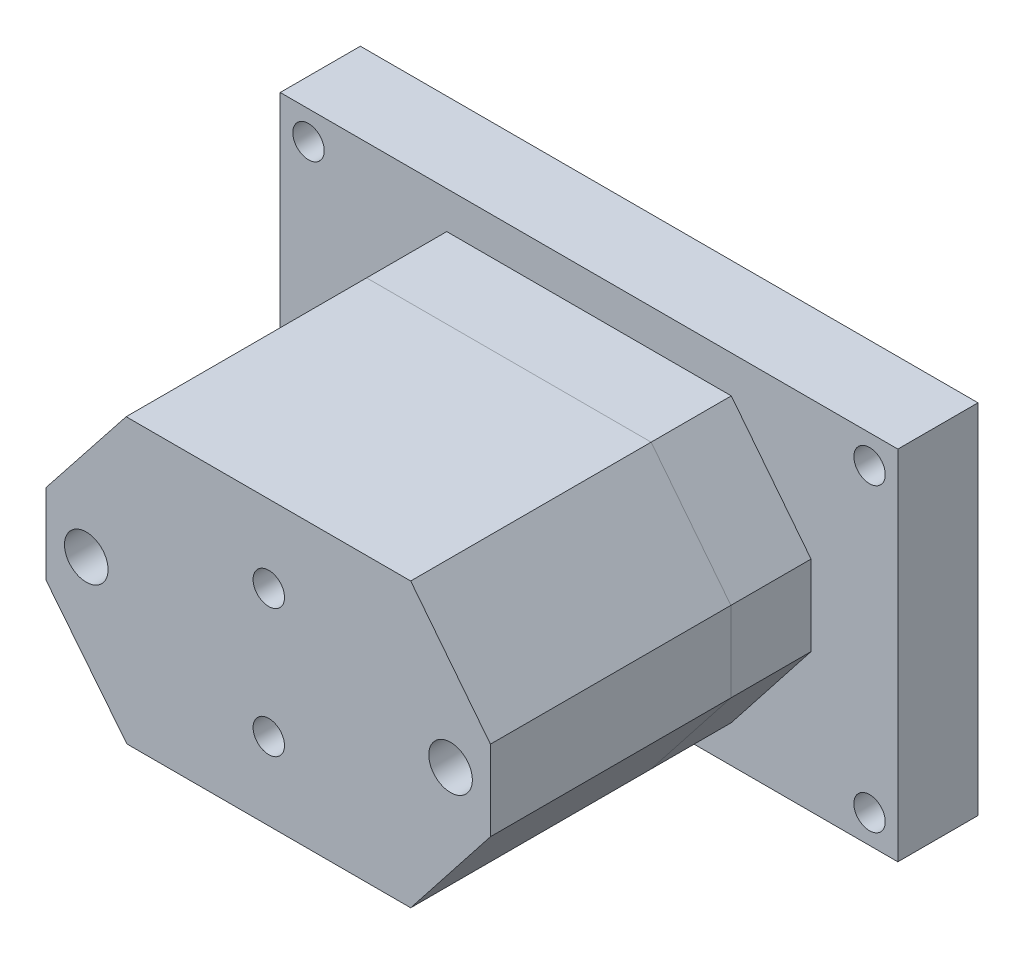
from build123d import *

# Parameters (mm, degrees)
CROQUIS1_W                   = 38.5
CROQUIS1_H                   = 38.5
CROQUIS1_R                   = 1.631954222
SALIENTE_EXTRUIR1_DEPTH      = 3.175
CROQUIS3_W                   = 45.084999084
CROQUIS3_H                   = 18.415000916
SALIENTE_EXTRUIR3_DEPTH      = 3.175
CROQUIS4_W                   = 18.415000916
CROQUIS4_H                   = 38.5
SALIENTE_EXTRUIR4_DEPTH      = 3.175
SALIENTE_EXTRUIR5_DEPTH      = 3.175
CROQUIS6_W                   = 45.084999084
CROQUIS6_H                   = 18.415000916
SALIENTE_EXTRUIR6_DEPTH      = 3.175
CROQUIS7_W                   = 12.817500305
CROQUIS7_H                   = 12.69999981
CROQUIS7_R                   = 2.4892
SALIENTE_EXTRUIR7_DEPTH      = 18.415001
SALIENTE_EXTRUIR8_DEPTH      = 35.179
SALIENTE_EXTRUIR8_DEPTH_BACK = 35.2425
CROQUIS10_W                  = 38.1
CROQUIS10_H                  = 44.85
CORTAR_EXTRUIR1_DEPTH        = 57.537814361
CROQUIS12_R                  = 12.7381
CORTAR_EXTRUIR2_DEPTH        = 71.036889764
CROQUIS13_R                  = 3.45
CORTAR_EXTRUIR3_DEPTH        = 73.335382738
CROQUIS14_R                  = 12.7381
SALIENTE_EXTRUIR9_DEPTH      = 3.175
CROQUIS15_R                  = 2.4892
CORTAR_EXTRUIR4_DEPTH        = 57.537814361
SALIENTE_EXTRUIR10_DEPTH     = 38.1
SALIENTE_EXTRUIR11_DEPTH     = 12.7
CROQUIS19_W                  = 97.8662
CROQUIS19_H                  = 56.642
CROQUIS19_R                  = 2.4892
SALIENTE_EXTRUIR12_DEPTH     = 12.7
CROQUIS20_R                  = 3.45
CROQUIS20_R_2                = 2.4892
CORTAR_EXTRUIR5_DEPTH        = 86.022216606


with BuildPart() as part:
    # Croquis1 → Saliente-Extruir1 (new body)
    with BuildSketch(Plane.XY):
        Rectangle(CROQUIS1_W, CROQUIS1_H)
        with Locations((-14, 14)):
            Circle(CROQUIS1_R, mode=Mode.SUBTRACT)
        with Locations((14, 14)):
            Circle(CROQUIS1_R, mode=Mode.SUBTRACT)
        with Locations(Location((14, -14, 0), (0, 0, 180))):
            Circle(CROQUIS1_R, mode=Mode.SUBTRACT)
        with Locations(Location((-14, -14, 0), (0, 0, 180))):
            Circle(CROQUIS1_R, mode=Mode.SUBTRACT)
        with BuildLine():
            Line((4.778981922, 6.730999947), (11.112500191, 6.730999947))
            Line((11.112500191, 6.730999947), (11.112500191, -6.730999947))
            Line((11.112500191, -6.730999947), (4.778981922, -6.730999947))
            ThreePointArc((4.778981922, -6.730999947), (0, -8.255000211), (-4.778981922, -6.730999947))
            Line((-4.778981922, -6.730999947), (-11.112500191, -6.730999947))
            Line((-11.112500191, -6.730999947), (-11.112500191, 6.730999947))
            Line((-11.112500191, 6.730999947), (-4.778981922, 6.730999947))
            ThreePointArc((-4.778981922, 6.730999947), (0, 8.255000211), (4.778981922, 6.730999947))
        make_face(mode=Mode.SUBTRACT)
    extrude(amount=SALIENTE_EXTRUIR1_DEPTH)

    # Croquis3 → Saliente-Extruir3 (add)
    with BuildSketch(Plane.XZ.offset(19.25)):
        with Locations((0, 9.207500458)):
            Rectangle(CROQUIS3_W, CROQUIS3_H)
    extrude(amount=SALIENTE_EXTRUIR3_DEPTH)

    # Croquis4 → Saliente-Extruir4 (add)
    with BuildSketch(Plane.ZY.offset(19.25)):
        with Locations((9.207500458, 0)):
            Rectangle(CROQUIS4_W, CROQUIS4_H)
    extrude(amount=SALIENTE_EXTRUIR4_DEPTH)

    # Croquis5 → Saliente-Extruir5 (add)
    with BuildSketch(Plane(origin=(19.25, 0, 0), x_dir=(0, 0, -1), z_dir=(1, 0, 0))):
        with BuildLine():
            Line((-12.617739677, -7.684936523), (-18.415000916, -7.684936523))
            Line((-18.415000916, -7.684936523), (-18.415000916, 19.25))
            Line((-18.415000916, 19.25), (0, 19.25))
            Line((0, 19.25), (0, -19.25))
            Line((0, -19.25), (-18.415000916, -19.25))
            Line((-18.415000916, -19.25), (-18.415000916, -12.304718971))
            Line((-18.415000916, -12.304718971), (-12.348668098, -12.304718971))
            ThreePointArc((-12.348668098, -12.304718971), (-10.544975303, -9.881938833), (-12.617739677, -7.684936523))
        make_face()
    extrude(amount=SALIENTE_EXTRUIR5_DEPTH)

    # Croquis6 → Saliente-Extruir6 (add)
    with BuildSketch(Plane(origin=(0, 19.25, 0), x_dir=(1, 0, 0), z_dir=(0, 1, 0))):
        with Locations((0, -9.207500458)):
            Rectangle(CROQUIS6_W, CROQUIS6_H)
    extrude(amount=SALIENTE_EXTRUIR6_DEPTH)

    # Croquis7 → Saliente-Extruir7 (add)
    # profile 1 of 2: a face of its own
    with BuildSketch(Plane.XY):
        with Locations((-28.833750153, 0)):
            Rectangle(CROQUIS7_W, CROQUIS7_H)
        with Locations((-28.833750153, 0)):
            Circle(CROQUIS7_R, mode=Mode.SUBTRACT)
    # profile 2 of 2: a face of its own
    with BuildSketch(Plane.XY):
        with Locations((28.833750153, 0)):
            Rectangle(CROQUIS7_W, CROQUIS7_H)
        with Locations(Location((28.833750153, 0, 0), (0, 0, 180))):
            Circle(CROQUIS7_R, mode=Mode.SUBTRACT)
    extrude(amount=SALIENTE_EXTRUIR7_DEPTH)


with BuildPart() as body_2:
    # Croquis10 → Saliente-Extruir8 (new, two sides: drawn at the far end of the back side and taken through both)
    with BuildSketch(Plane(origin=(0, 0, 0), x_dir=(0, 0, -1), z_dir=(1, 0, 0)).offset(-SALIENTE_EXTRUIR8_DEPTH_BACK)):
        with Locations((21.59, 0)):
            Rectangle(CROQUIS10_W, CROQUIS10_H)
    extrude(amount=SALIENTE_EXTRUIR8_DEPTH + SALIENTE_EXTRUIR8_DEPTH_BACK)

    # Croquis11 → Cortar-Extruir1 (cut, through all)
    with BuildSketch(Plane.XY.offset(-2.54)):
        Polygon((22.542499542, 22.425), (22.542499542, 6.349999905), (35.242500305, 6.349999905), align=None)
        Polygon((35.242500305, -6.349999905), (22.542499542, -6.349999905), (22.542499542, -22.425), align=None)
        Polygon((-22.542499542, 22.425), (-22.542499542, 6.349999905), (-35.242500305, 6.349999905), align=None)
        Polygon((-35.242500305, -6.349999905), (-22.425, -6.349999905), (-22.425, -22.425), align=None)
    extrude(amount=-CORTAR_EXTRUIR1_DEPTH, mode=Mode.SUBTRACT)


with BuildPart() as cortar_extruir1_piece_1:
    # of the separate pieces the step leaves, piece 1, a body of its own (cortar_extruir1_pieces)
    add(body_2.part.solids().sort_by_distance((-22.425, -6.349999905, -2.54))[0])

    # Croquis12 → Cortar-Extruir2 (cut, through all)
    with BuildSketch(Plane(origin=(0, 22.425, 0), x_dir=(1, 0, 0), z_dir=(0, 1, 0))):
        with Locations(Location((0, 21.59, 0), (0, 0, 270))):
            Circle(CROQUIS12_R)
    extrude(amount=-CORTAR_EXTRUIR2_DEPTH, mode=Mode.SUBTRACT)

    # Croquis13 → Cortar-Extruir3 (cut, symmetric)
    with BuildSketch(Plane(origin=(0, 0, -40.64), x_dir=(-1, 0, 0), z_dir=(0, 0, -1))):
        with Locations((-28.860749771, 0)):
            Circle(CROQUIS13_R)
    cortar_extruir3 = extrude(amount=CORTAR_EXTRUIR3_DEPTH, both=True, mode=Mode.SUBTRACT)

    # Simetría1: Cortar-Extruir3 across plane
    add(cortar_extruir3.mirror(Plane(origin=(0, 0, 0), x_dir=(0, 0, 1), z_dir=(1, 0, 0))), mode=Mode.SUBTRACT)

    # Croquis14 → Saliente-Extruir9 (add)
    with BuildSketch(Plane(origin=(0, 22.425, 0), x_dir=(1, 0, 0), z_dir=(0, 1, 0))):
        with Locations(Location((0, 21.59, 0), (0, 0, 270))):
            Circle(CROQUIS14_R)
    extrude(amount=-SALIENTE_EXTRUIR9_DEPTH)

    # Croquis15 → Cortar-Extruir4 (cut, through all)
    with BuildSketch(Plane.XY.offset(-2.54)):
        with Locations((0.058749771, 10.15983014)):
            Circle(CROQUIS15_R)
        with Locations(Location((0.058749771, -10.15983014, 0), (0, 0, 268.647586966))):
            Circle(CROQUIS15_R)
    extrude(amount=-CORTAR_EXTRUIR4_DEPTH, mode=Mode.SUBTRACT)

    # Croquis17 → Saliente-Extruir10 (add)
    with BuildSketch(Plane.XY.offset(-2.54)):
        Polygon((-35.242500305, 6.349999905), (-22.542499542, 22.425), (-22.542499542, 6.349999905), align=None)
        Polygon((-22.425, -22.425), (-35.242500305, -6.349999905), (-22.425, -6.349999905), align=None)
        Polygon((22.542499542, -22.425), (35.179, -6.349999905), (22.542499542, -6.349999905), align=None)
        Polygon((22.542499542, 22.425), (35.179, 6.349999905), (22.542499542, 6.349999905), align=None)
    extrude(amount=-SALIENTE_EXTRUIR10_DEPTH)


with BuildPart() as cortar_extruir1_piece_2:
    # of the separate pieces the step leaves, piece 2, a body of its own (cortar_extruir1_pieces)
    add(body_2.part.solids().sort_by_distance((-35.2425, -22.425, -40.64))[0])


with BuildPart() as cortar_extruir1_piece_3:
    # of the separate pieces the step leaves, piece 3, a body of its own (cortar_extruir1_pieces)
    add(body_2.part.solids().sort_by_distance((-35.2425, 22.425, -2.54))[0])


with BuildPart() as cortar_extruir1_piece_4:
    # of the separate pieces the step leaves, piece 4, a body of its own (cortar_extruir1_pieces)
    add(body_2.part.solids().sort_by_distance((35.179, 22.425, -2.54))[0])


with BuildPart() as cortar_extruir1_piece_5:
    # of the separate pieces the step leaves, piece 5, a body of its own (cortar_extruir1_pieces)
    add(body_2.part.solids().sort_by_distance((35.179, -22.425, -40.64))[0])


with BuildPart() as body_2_2:
    # Croquis18 → Saliente-Extruir11 (new body)
    with BuildSketch(Plane(origin=(0, 0, -40.64), x_dir=(-1, 0, 0), z_dir=(0, 0, -1))):
        Polygon((-22.542499542, 22.425), (22.542499542, 22.425), (35.242500305, 6.349999905), (35.242500305, -6.349999905), (22.425, -22.425), (-22.542499542, -22.425), (-35.179, -6.349999905), (-35.179, 6.349999905), align=None)
    extrude(amount=SALIENTE_EXTRUIR11_DEPTH)

    # Croquis19 → Saliente-Extruir12 (add)
    with BuildSketch(Plane(origin=(0, 0, -53.34), x_dir=(-1, 0, 0), z_dir=(0, 0, -1))):
        Rectangle(CROQUIS19_W, CROQUIS19_H)
        with Locations((-44.45, 23.8125)):
            Circle(CROQUIS19_R, mode=Mode.SUBTRACT)
        with Locations((-44.45, -23.8125)):
            Circle(CROQUIS19_R, mode=Mode.SUBTRACT)
        with Locations(Location((44.45, -23.8125, 0), (0, 0, 180))):
            Circle(CROQUIS19_R, mode=Mode.SUBTRACT)
        with Locations(Location((44.45, 23.8125, 0), (0, 0, 180))):
            Circle(CROQUIS19_R, mode=Mode.SUBTRACT)
    extrude(amount=SALIENTE_EXTRUIR12_DEPTH)

    # Croquis20 → Cortar-Extruir5 (cut, through all)
    with BuildSketch(Plane.XY.offset(-2.54)):
        with Locations((28.860749771, 0)):
            Circle(CROQUIS20_R)
        with Locations((0.058749771, -10.15983014)):
            Circle(CROQUIS20_R_2)
        with Locations((-28.860749771, 0)):
            Circle(CROQUIS20_R)
        with Locations((0.058749771, 10.15983014)):
            Circle(CROQUIS20_R_2)
    extrude(amount=-CORTAR_EXTRUIR5_DEPTH, mode=Mode.SUBTRACT)


solid = Compound([cortar_extruir1_piece_1.part, body_2_2.part])
